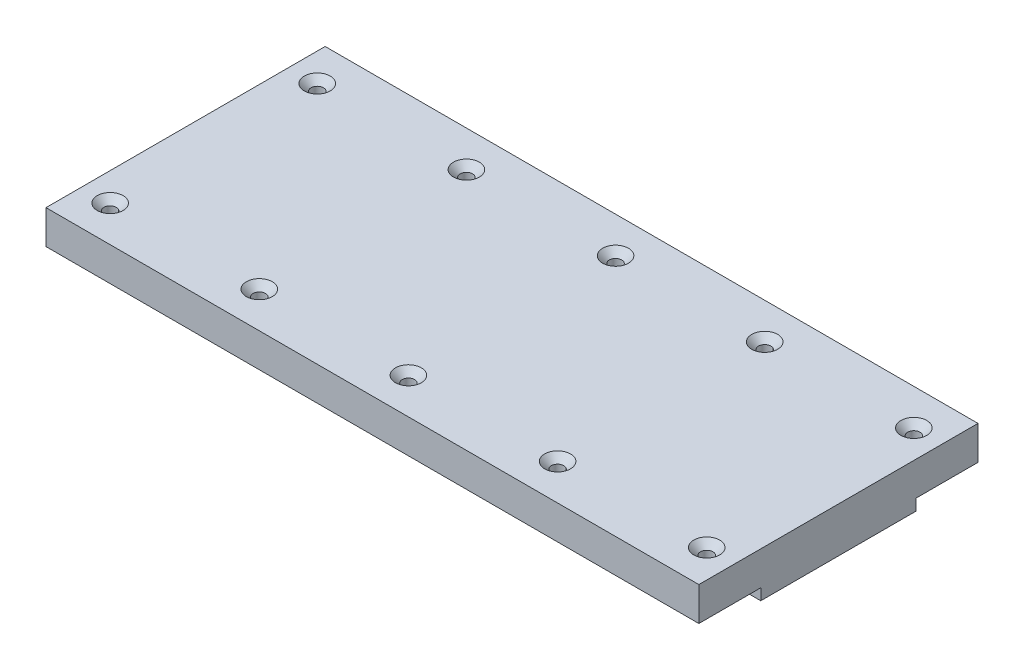
from build123d import *

# Parameters (mm, degrees)
SKETCH_1_W                    = 580
SKETCH_1_H                    = 138
EXTRUDE_1_DEPTH               = 10
SKETCH_2_W                    = 580
SKETCH_2_H                    = 248
EXTRUDE_2_DEPTH               = 30
HOLE_WIZARD_M10_1_D           = 11
HOLE_WIZARD_M10_1_DEPTH       = 59
HOLE_WIZARD_M10_1_CSINK_D     = 23
HOLE_WIZARD_M10_1_CSINK_ANGLE = 90
HOLE_WIZARD_M10_1_TIP         = 3.304733405


with BuildPart() as part:
    # 草圖1 → 填料-伸長1 (new body)
    with BuildSketch(Plane(origin=(0, 0, 0), x_dir=(1, 0, 0), z_dir=(0, 1, 0))):
        Rectangle(SKETCH_1_W, SKETCH_1_H)
    extrude(amount=EXTRUDE_1_DEPTH)

    # 草圖2 → 填料-伸長2 (add)
    with BuildSketch(Plane(origin=(0, 10, 0), x_dir=(1, 0, 0), z_dir=(0, 1, 0))):
        Rectangle(SKETCH_2_W, SKETCH_2_H)
    extrude(amount=EXTRUDE_2_DEPTH)

    # M10 錐坑平頭螺釘的錐孔1
    with Locations(Plane(origin=(-265, 40, -92), x_dir=(0, 0, 1), z_dir=(0, 1, 0))):
        with Locations((0, 0), (184, 0), (184, 132.5), (0, 132.5), (0, 265), (184, 265), (184, 397.5), (184, 530), (0, 530), (0, 397.5)):
            CounterSinkHole(HOLE_WIZARD_M10_1_D / 2, HOLE_WIZARD_M10_1_CSINK_D / 2, depth=HOLE_WIZARD_M10_1_DEPTH, counter_sink_angle=HOLE_WIZARD_M10_1_CSINK_ANGLE)
            with Locations((0, 0, -(HOLE_WIZARD_M10_1_DEPTH + HOLE_WIZARD_M10_1_TIP / 2))):  # 118° drill point
                Cone(0, HOLE_WIZARD_M10_1_D / 2, HOLE_WIZARD_M10_1_TIP, mode=Mode.SUBTRACT)


solid = part.part
